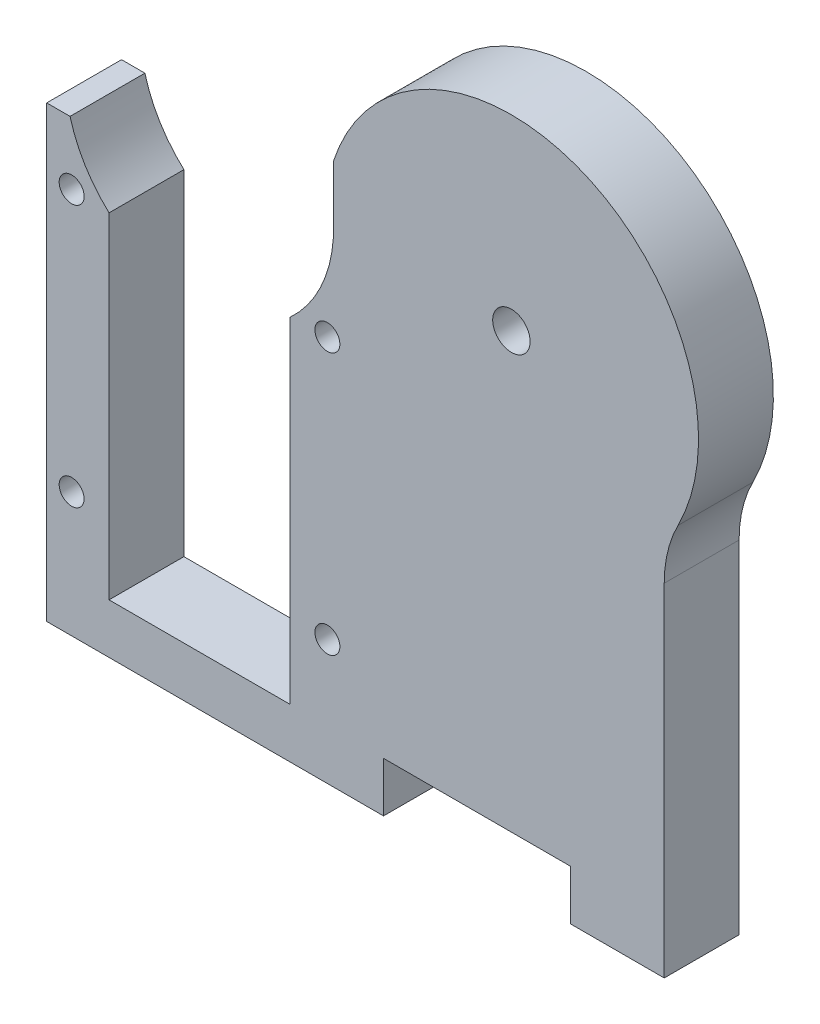
from build123d import *

# Parameters (mm, degrees)
SKETCH_1_R          = 1
SKETCH_1_R_2        = 1.5
EXTRUDE_1_DEPTH     = 6
SKETCH_3_W          = 15
SKETCH_3_H          = 4
CUT_EXTRUDE_1_DEPTH = 10


with BuildPart() as part:
    # Эскиз1 → Бобышка-Вытянуть1 (new body)
    with BuildSketch(Plane.XY):
        with BuildLine():
            Line((0, 0), (0, 32))
            Line((0, 32), (1.872137409, 32))
            ThreePointArc((1.872137409, 32), (3.069970858, 29.210301659), (5, 26.866755347))
            Line((5, 26.866755347), (5, 0))
            Line((5, 0), (19.5, 0))
            Line((19.5, 0), (19.5, 26.866755347))
            ThreePointArc((19.5, 26.866755347), (22.14801609, 30.609753984), (22.995479479, 35.115731548))
            Line((22.995479479, 35.115731548), (22.995479479, 39.473981947))
            ThreePointArc((22.995479479, 39.473981947), (43.022434445, 48.648827827), (50.6, 27.964601411))
            ThreePointArc((50.6, 27.964601411), (49.778888952, 25.750204045), (49.5, 23.404996165))
            Line((49.5, 23.404996165), (49.5, -4))
            Line((49.5, -4), (0, -4))
            Line((0, -4), (0, 0))
        make_face()
        with Locations((2, 27)):
            Circle(SKETCH_1_R, mode=Mode.SUBTRACT)
        with Locations(Location((22.5, 27, 0), (0, 0, 180))):
            Circle(SKETCH_1_R, mode=Mode.SUBTRACT)
        with Locations((22.5, 6)):
            Circle(SKETCH_1_R, mode=Mode.SUBTRACT)
        with Locations(Location((2, 6, 0), (0, 0, 180))):
            Circle(SKETCH_1_R, mode=Mode.SUBTRACT)
        with Locations((37.25, 34.80400928)):
            Circle(SKETCH_1_R_2, mode=Mode.SUBTRACT)
    extrude(amount=EXTRUDE_1_DEPTH)

    # Эскиз3 → Вырез-Вытянуть1 (cut)
    with BuildSketch(Plane.XY.offset(6)):
        with Locations((34.5, -2)):
            Rectangle(SKETCH_3_W, SKETCH_3_H)
    extrude(amount=-CUT_EXTRUDE_1_DEPTH, mode=Mode.SUBTRACT)


solid = part.part
